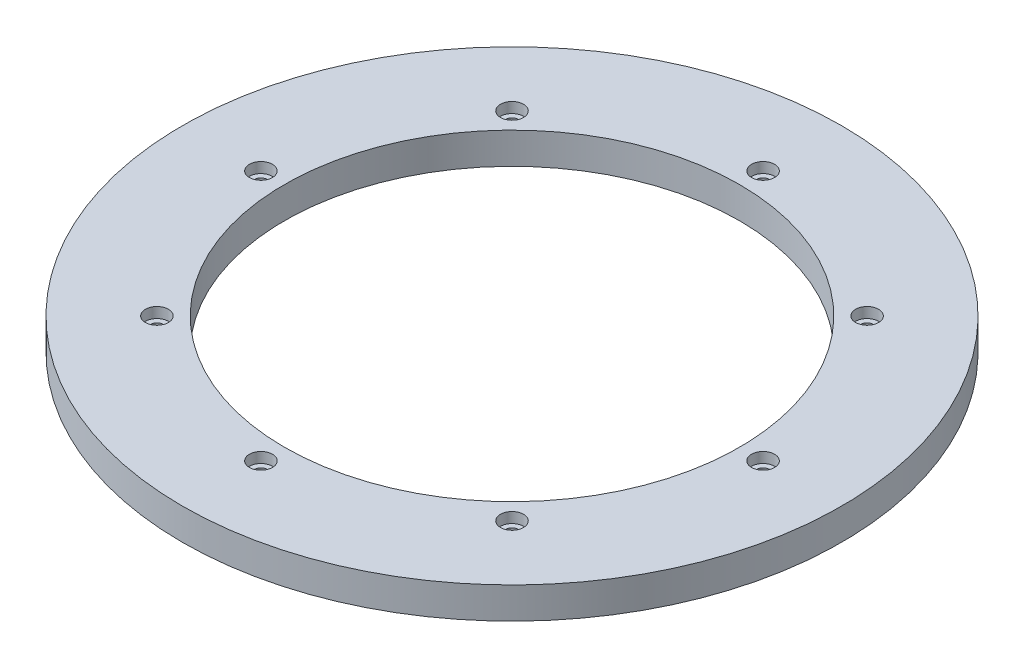
from build123d import *

# Parameters (mm, degrees)
SKETCH1_W          = 97.5
SKETCH1_H          = 30
SKETCH2_R          = 11
CUT_EXTRUDE1_DEPTH = 10
SKETCH3_R          = 6
CUT_EXTRUDE2_DEPTH = 447.486281987


with BuildPart() as part:
    # Sketch1 → Revolve1 (revolve)
    with BuildSketch(Plane(origin=(0, 0, 0), x_dir=(0, 0, -1), z_dir=(1, 0, 0)), mode=Mode.PRIVATE) as revolve1_sk:
        with Locations((-266.250000002, 29.605962764)):
            Rectangle(SKETCH1_W, SKETCH1_H)
    revolve(revolve1_sk.sketch.rotate(Axis((0, -1000, 0), (0, 1, 0)), 180), axis=Axis((0, -1000, 0), (0, 1, 0)))

    # Sketch2 → Cut-Extrude1 (cut)
    with BuildSketch(Plane(origin=(0, 44.605962764, 0), x_dir=(1, 0, 0), z_dir=(0, 1, 0))):
        with Locations(Location((0, 240, 0), (0, 0, 270))):
            Circle(SKETCH2_R)
        with Locations(Location((169.705627485, 169.705627485, 0), (0, 0, 270))):
            Circle(SKETCH2_R)
        with Locations(Location((240, 0, 0), (0, 0, 270))):
            Circle(SKETCH2_R)
        with Locations(Location((169.705627485, -169.705627485, 0), (0, 0, 270))):
            Circle(SKETCH2_R)
        with Locations(Location((0, -240, 0), (0, 0, 270))):
            Circle(SKETCH2_R)
        with Locations(Location((-169.705627485, -169.705627485, 0), (0, 0, 270))):
            Circle(SKETCH2_R)
        with Locations(Location((-240, 0, 0), (0, 0, 270))):
            Circle(SKETCH2_R)
        with Locations(Location((-169.705627485, 169.705627485, 0), (0, 0, 270))):
            Circle(SKETCH2_R)
    extrude(amount=-CUT_EXTRUDE1_DEPTH, mode=Mode.SUBTRACT)

    # Sketch3 → Cut-Extrude2 (cut, through all)
    with BuildSketch(Plane(origin=(0, 44.605962764, 0), x_dir=(1, 0, 0), z_dir=(0, 1, 0))):
        with Locations(Location((0, 240, 0), (0, 0, 270))):
            Circle(SKETCH3_R)
        with Locations(Location((169.705627485, 169.705627485, 0), (0, 0, 270))):
            Circle(SKETCH3_R)
        with Locations(Location((240, 0, 0), (0, 0, 270))):
            Circle(SKETCH3_R)
        with Locations(Location((169.705627485, -169.705627485, 0), (0, 0, 270))):
            Circle(SKETCH3_R)
        with Locations(Location((0, -240, 0), (0, 0, 270))):
            Circle(SKETCH3_R)
        with Locations(Location((-169.705627485, -169.705627485, 0), (0, 0, 270))):
            Circle(SKETCH3_R)
        with Locations(Location((-240, 0, 0), (0, 0, 270))):
            Circle(SKETCH3_R)
        with Locations(Location((-169.705627485, 169.705627485, 0), (0, 0, 270))):
            Circle(SKETCH3_R)
    extrude(amount=-CUT_EXTRUDE2_DEPTH, mode=Mode.SUBTRACT)


solid = part.part
